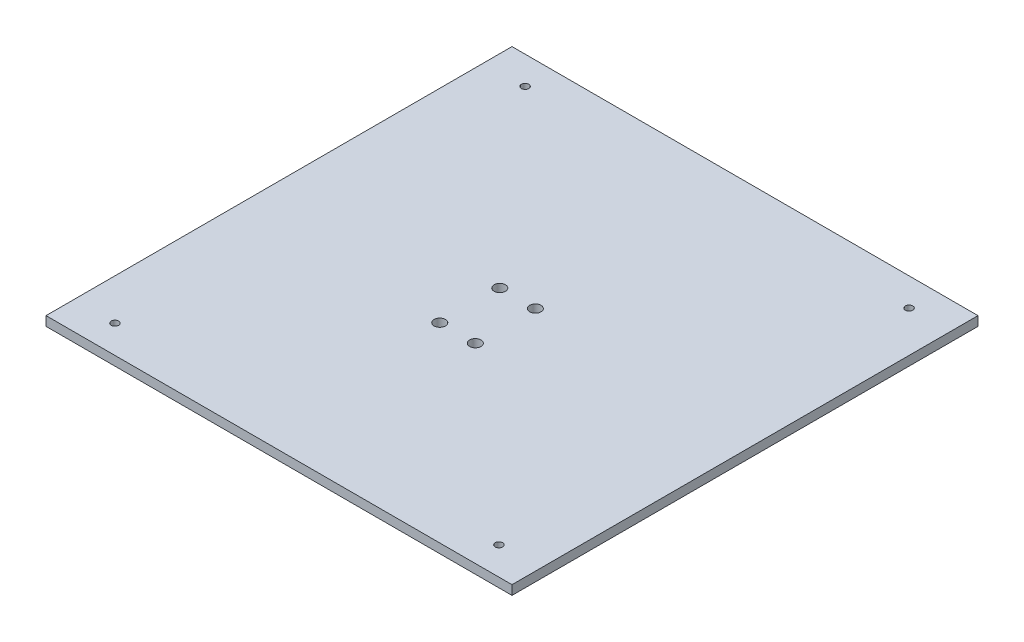
from build123d import *

# Parameters (mm, degrees)
SKETCH2_W            = 250
SKETCH2_H            = 250
BOSS_EXTRUDE1_DEPTH  = 5
SKETCH3_R            = 2
SKETCH3_R_2          = 3.05
CUT_EXTRUDE1_DEPTH   = 354.588744165
LPATTERN1_COUNT      = 2
LPATTERN1_PITCH      = 220
LPATTERN1_COUNT_DIR2 = 2
LPATTERN1_PITCH_DIR2 = 206


with BuildPart() as part:
    # Sketch2 → Boss-Extrude1 (new body)
    with BuildSketch(Plane(origin=(0, 0, 0), x_dir=(1, 0, 0), z_dir=(0, 1, 0))):
        with Locations((125, 125)):
            Rectangle(SKETCH2_W, SKETCH2_H)
    extrude(amount=BOSS_EXTRUDE1_DEPTH)

    # Sketch3 → Cut-Extrude1 (cut, through all)
    with BuildSketch(Plane(origin=(0, 5, 0), x_dir=(1, 0, 0), z_dir=(0, 1, 0))):
        with Locations(Location((22, 15, 0), (0, 0, 270))):
            Circle(SKETCH3_R)
        with Locations(Location((108.9, 134.54, 0), (0, 0, 270))):
            Circle(SKETCH3_R_2)
        with Locations(Location((127.98, 134.54, 0), (0, 0, 270))):
            Circle(SKETCH3_R_2)
        with Locations(Location((127.98, 102.34, 0), (0, 0, 270))):
            Circle(SKETCH3_R_2)
        with Locations(Location((108.9, 102.34, 0), (0, 0, 270))):
            Circle(SKETCH3_R_2)
    cut_extrude1 = extrude(amount=-CUT_EXTRUDE1_DEPTH, mode=Mode.SUBTRACT)

    # LPattern1: Cut-Extrude1 2 × 2
    with Locations(*[(j * LPATTERN1_PITCH_DIR2, 0, -i * LPATTERN1_PITCH) for i in range(LPATTERN1_COUNT) for j in range(LPATTERN1_COUNT_DIR2) if (i, j) != (0, 0)]):
        add(cut_extrude1, mode=Mode.SUBTRACT)


solid = part.part
